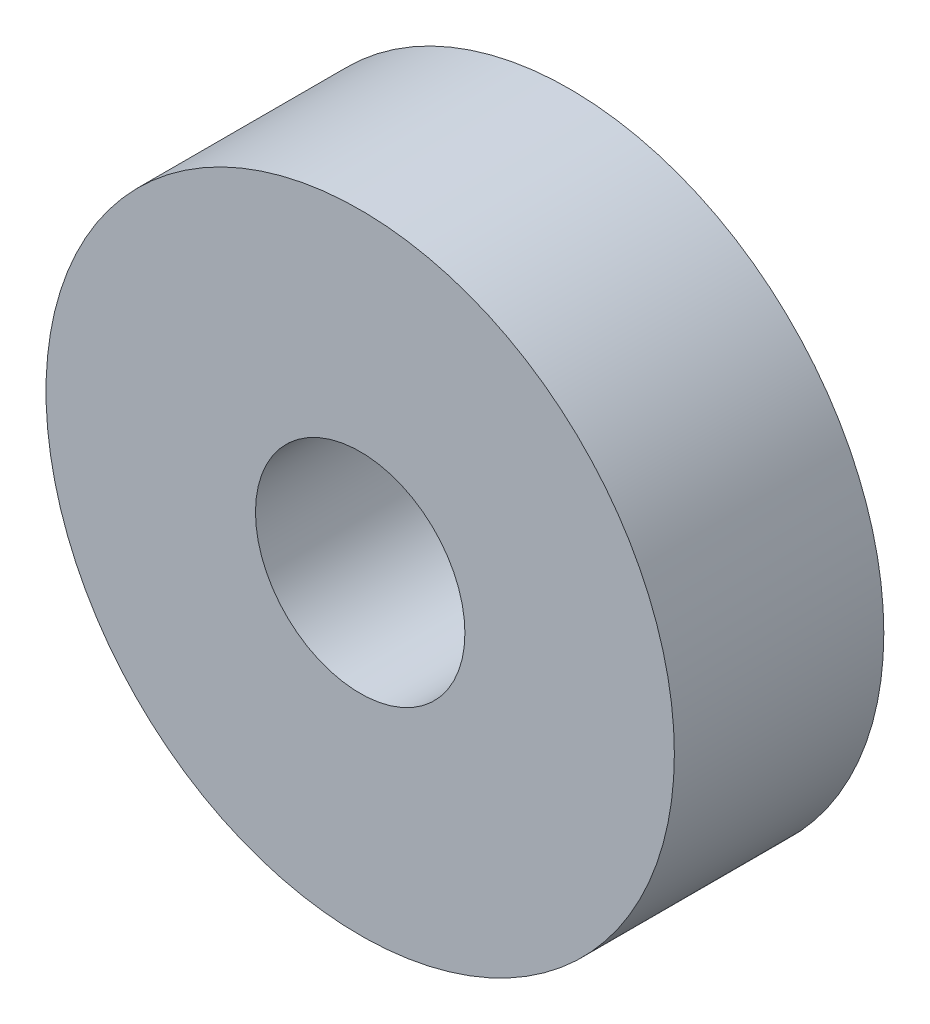
from build123d import *

# Parameters (mm, degrees)
SKETCH1_R           = 6
SKETCH1_R_2         = 2
BOSS_EXTRUDE1_DEPTH = 2


with BuildPart() as part:
    # Sketch1 → Boss-Extrude1 (new, symmetric)
    with BuildSketch(Plane.XY):
        Circle(SKETCH1_R)
        Circle(SKETCH1_R_2, mode=Mode.SUBTRACT)
    extrude(amount=BOSS_EXTRUDE1_DEPTH, both=True)


solid = part.part
